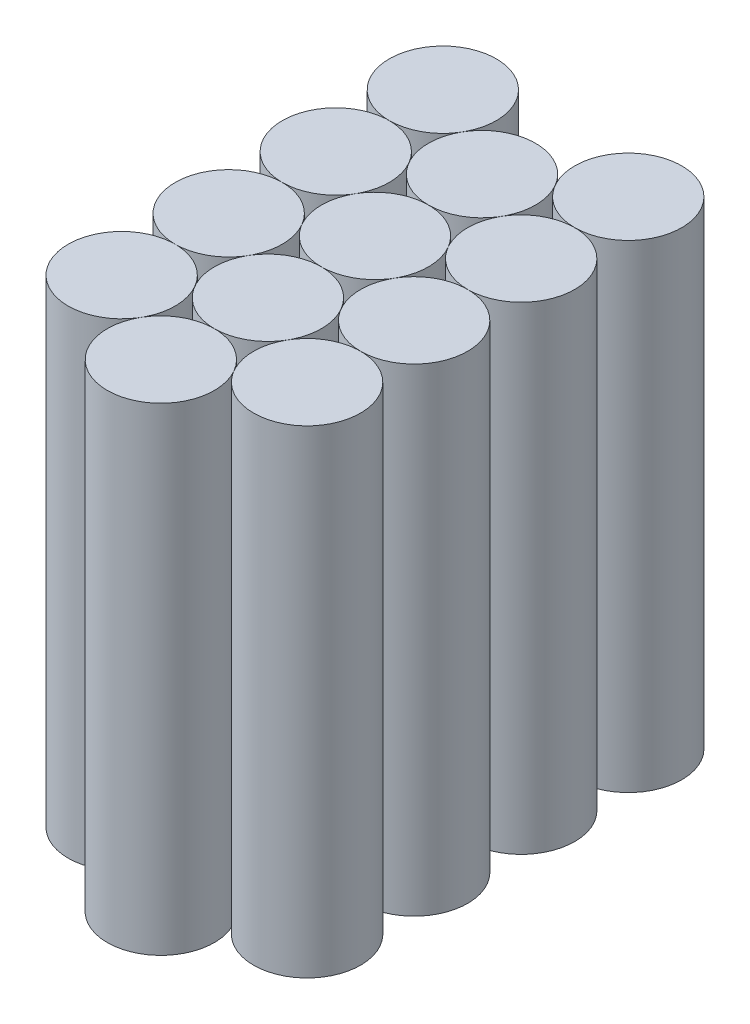
from build123d import *

# Parameters (mm, degrees)
SKETCH1_R           = 7.5
BOSS_EXTRUDE1_DEPTH = 67


with BuildPart() as part:
    # Sketch1 → Boss-Extrude1 (new body)
    with BuildSketch(Plane(origin=(0, 0, 0), x_dir=(1, 0, 0), z_dir=(0, 1, 0))):
        with Locations(Location((12.990381057, 7.5, 0), (0, 0, 270))):
            Circle(SKETCH1_R)
        with Locations(Location((0, 0, 0), (0, 0, 270))):
            Circle(SKETCH1_R)
        with Locations(Location((0, 15, 0), (0, 0, 270))):
            Circle(SKETCH1_R)
        with Locations(Location((-12.990381057, 7.5, 0), (0, 0, 270))):
            Circle(SKETCH1_R)
        with Locations(Location((-12.990381057, 22.5, 0), (0, 0, 270))):
            Circle(SKETCH1_R)
        with Locations(Location((-12.990381057, 37.5, 0), (0, 0, 270))):
            Circle(SKETCH1_R)
        with Locations(Location((-12.990381057, 52.5, 0), (0, 0, 270))):
            Circle(SKETCH1_R)
        with Locations(Location((0, 45, 0), (0, 0, 270))):
            Circle(SKETCH1_R)
        with Locations(Location((0, 30, 0), (0, 0, 270))):
            Circle(SKETCH1_R)
        with Locations(Location((12.990381057, 52.5, 0), (0, 0, 270))):
            Circle(SKETCH1_R)
        with Locations(Location((12.990381057, 37.5, 0), (0, 0, 270))):
            Circle(SKETCH1_R)
        with Locations(Location((12.990381057, 22.5, 0), (0, 0, 270))):
            Circle(SKETCH1_R)
    extrude(amount=BOSS_EXTRUDE1_DEPTH)


solid = part.part
